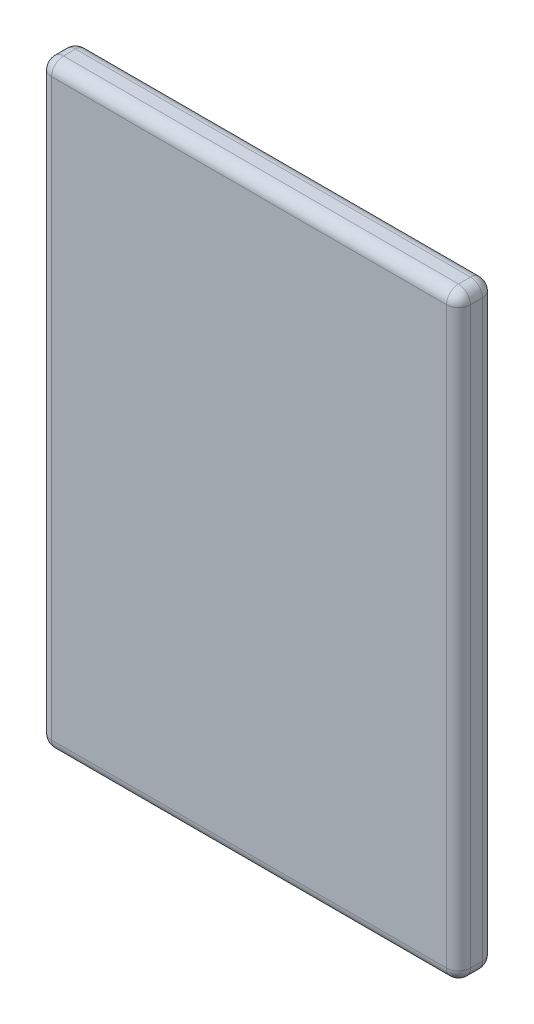
from build123d import *

# Parameters (mm, degrees)
SKETCH2_W           = 70
SKETCH2_H           = 100
BOSS_EXTRUDE1_DEPTH = 6
FILLET1_R           = 2


with BuildPart() as part:
    # Sketch2 → Boss-Extrude1 (new body)
    with BuildSketch(Plane.XY):
        with Locations((35, 50)):
            Rectangle(SKETCH2_W, SKETCH2_H)
    extrude(amount=BOSS_EXTRUDE1_DEPTH)

    # Fillet1
    fillet1_edges = [part.edges().sort_by_distance(p)[0] for p in [
        (70, 50, 6),
        (35, 100, 6),
        (0, 50, 6),
        (35, 100, 0),
        (70, 50, 0),
        (35, 0, 0),
        (0, 50, 0),
        (35, 0, 6),
        (0, 100, 3),
        (70, 100, 3),
        (70, 0, 3),
        (0, 0, 3),
    ]]
    fillet(fillet1_edges, radius=FILLET1_R)


solid = part.part
